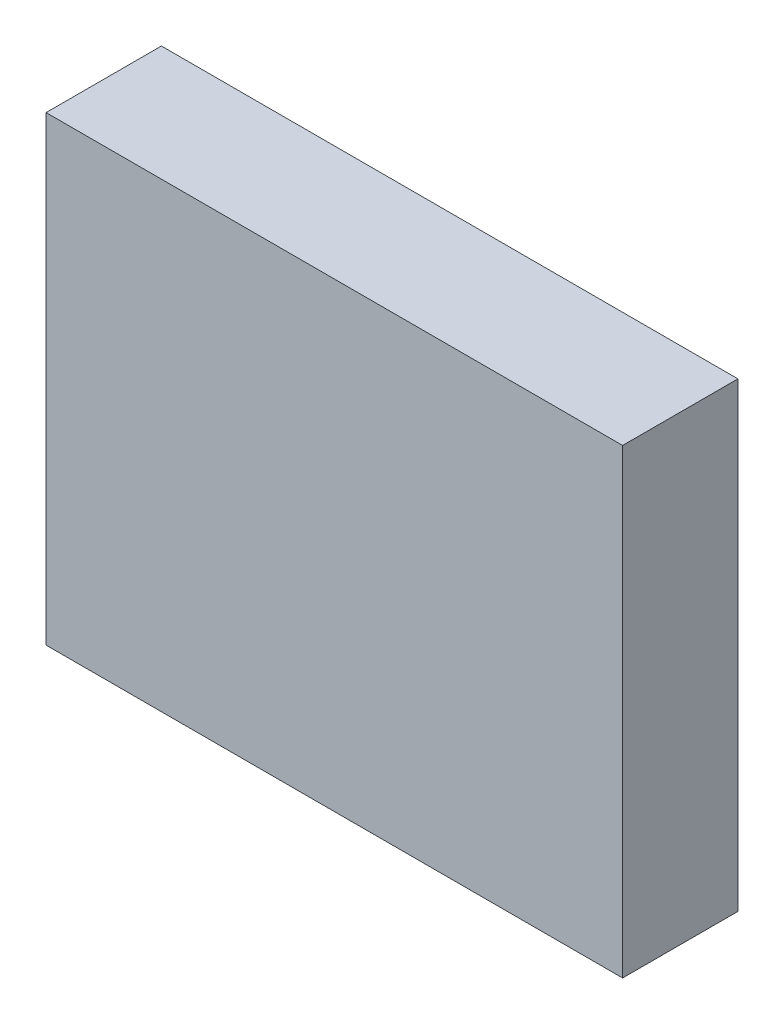
from build123d import *

# Parameters (mm, degrees)
SKETCH1_W           = 50
SKETCH1_H           = 40
BOSS_EXTRUDE1_DEPTH = 10


with BuildPart() as part:
    # Sketch1 → Boss-Extrude1 (new body)
    with BuildSketch(Plane.XY):
        Rectangle(SKETCH1_W, SKETCH1_H)
    extrude(amount=BOSS_EXTRUDE1_DEPTH)


solid = part.part
